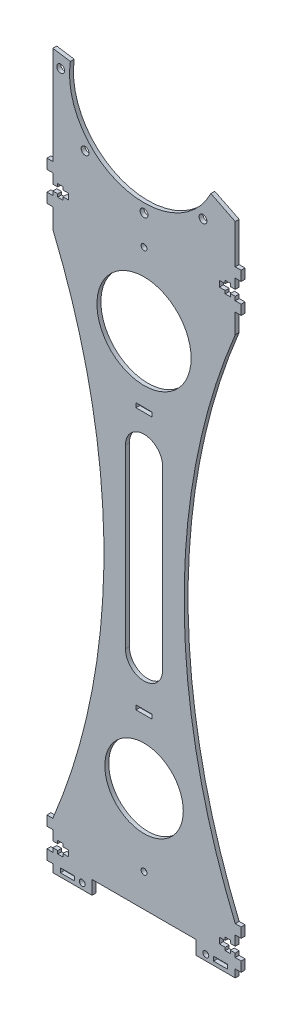
from build123d import *

# Parameters (mm, degrees)
SKETCH_3_R      = 1.5
SKETCH_3_R_2    = 2
SKETCH_3_R_3    = 24.001454592
SKETCH_3_R_4    = 20
SKETCH_3_W      = 7.2
SKETCH_3_H      = 2.2
SKETCH_3_W_2    = 8.2
EXTRUDE_1_DEPTH = 2


with BuildPart() as part:
    # 草图3 → 凸台-拉伸1 (new body)
    with BuildSketch(Plane.XY):
        with BuildLine():
            Line((-46.5, 360.009783315), (-46.5, 310.009783315))
            Line((-46.5, 310.009783315), (-49.5, 310.009783315))
            Line((-49.5, 310.009783315), (-49.5, 305.009783315))
            Line((-49.5, 305.009783315), (-46.5, 305.009783315))
            Line((-46.5, 305.009783315), (-46.5, 300.009783315))
            Line((-46.5, 300.009783315), (-44, 300.009783315))
            Line((-44, 300.009783315), (-44, 301.509783315))
            Line((-44, 301.509783315), (-41.4, 301.509783315))
            Line((-41.4, 301.509783315), (-41.4, 300.009783315))
            Line((-41.4, 300.009783315), (-38.4, 300.009783315))
            Line((-38.4, 300.009783315), (-38.4, 297.009783315))
            Line((-38.4, 297.009783315), (-41.4, 297.009783315))
            Line((-41.4, 297.009783315), (-41.4, 295.509783315))
            Line((-41.4, 295.509783315), (-44, 295.509783315))
            Line((-44, 295.509783315), (-44, 297.009783315))
            Line((-44, 297.009783315), (-46.5, 297.009783315))
            Line((-46.5, 297.009783315), (-46.5, 295.009783315))
            Line((-46.5, 295.009783315), (-49.5, 295.009783315))
            Line((-49.5, 295.009783315), (-49.5, 290.009783315))
            Line((-49.5, 290.009783315), (-46.5, 290.009783315))
            Line((-46.5, 290.009783315), (-46.5, 280.009783315))
            ThreePointArc((-46.5, 280.009783315), (-20.448024821, 150.009783315), (-46.5, 20.009783315))
            Line((-46.5, 20.009783315), (-49.5, 20.009783315))
            Line((-49.5, 20.009783315), (-49.5, 15.009783315))
            Line((-49.5, 15.009783315), (-46.5, 15.009783315))
            Line((-46.5, 15.009783315), (-46.5, 10.009783315))
            Line((-46.5, 10.009783315), (-44, 10.009783315))
            Line((-44, 10.009783315), (-44, 11.509783315))
            Line((-44, 11.509783315), (-41.4, 11.509783315))
            Line((-41.4, 11.509783315), (-41.4, 10.009783315))
            Line((-41.4, 10.009783315), (-38.4, 10.009783315))
            Line((-38.4, 10.009783315), (-38.4, 7.009783315))
            Line((-38.4, 7.009783315), (-41.4, 7.009783315))
            Line((-41.4, 7.009783315), (-41.4, 5.509783315))
            Line((-41.4, 5.509783315), (-44, 5.509783315))
            Line((-44, 5.509783315), (-44, 7.009783315))
            Line((-44, 7.009783315), (-46.5, 7.009783315))
            Line((-46.5, 7.009783315), (-46.5, 5.009783315))
            Line((-46.5, 5.009783315), (-49.5, 5.009783315))
            Line((-49.5, 5.009783315), (-49.5, 0.009783315))
            Line((-49.5, 0.009783315), (-46.5, 0.009783315))
            Line((-46.5, 0.009783315), (-46.5, -3.990216685))
            Line((-46.5, -3.990216685), (-26.5, -3.990216685))
            Line((-26.5, -3.990216685), (-26.5, 3.009783315))
            Line((-26.5, 3.009783315), (26.5, 3.009783315))
            Line((26.5, 3.009783315), (26.5, -3.990216685))
            Line((26.5, -3.990216685), (46.5, -3.990216685))
            Line((46.5, -3.990216685), (46.5, 0.009783315))
            Line((46.5, 0.009783315), (49.5, 0.009783315))
            Line((49.5, 0.009783315), (49.5, 5.009783315))
            Line((49.5, 5.009783315), (46.5, 5.009783315))
            Line((46.5, 5.009783315), (46.5, 7.009783315))
            Line((46.5, 7.009783315), (44, 7.009783315))
            Line((44, 7.009783315), (44, 5.509783315))
            Line((44, 5.509783315), (41.4, 5.509783315))
            Line((41.4, 5.509783315), (41.4, 7.009783315))
            Line((41.4, 7.009783315), (38.4, 7.009783315))
            Line((38.4, 7.009783315), (38.4, 10.009783315))
            Line((38.4, 10.009783315), (41.4, 10.009783315))
            Line((41.4, 10.009783315), (41.4, 11.509783315))
            Line((41.4, 11.509783315), (44, 11.509783315))
            Line((44, 11.509783315), (44, 10.009783315))
            Line((44, 10.009783315), (46.5, 10.009783315))
            Line((46.5, 10.009783315), (46.5, 15.009783315))
            Line((46.5, 15.009783315), (49.5, 15.009783315))
            Line((49.5, 15.009783315), (49.5, 20.009783315))
            Line((49.5, 20.009783315), (46.5, 20.009783315))
            ThreePointArc((46.5, 20.009783315), (20.448024821, 150.009783315), (46.5, 280.009783315))
            Line((46.5, 280.009783315), (46.5, 290.009783315))
            Line((46.5, 290.009783315), (49.5, 290.009783315))
            Line((49.5, 290.009783315), (49.5, 295.009783315))
            Line((49.5, 295.009783315), (46.5, 295.009783315))
            Line((46.5, 295.009783315), (46.5, 297.009783315))
            Line((46.5, 297.009783315), (44, 297.009783315))
            Line((44, 297.009783315), (44, 295.509783315))
            Line((44, 295.509783315), (41.4, 295.509783315))
            Line((41.4, 295.509783315), (41.4, 297.009783315))
            Line((41.4, 297.009783315), (38.4, 297.009783315))
            Line((38.4, 297.009783315), (38.4, 300.009783315))
            Line((38.4, 300.009783315), (41.4, 300.009783315))
            Line((41.4, 300.009783315), (41.4, 301.509783315))
            Line((41.4, 301.509783315), (44, 301.509783315))
            Line((44, 301.509783315), (44, 300.009783315))
            Line((44, 300.009783315), (46.5, 300.009783315))
            Line((46.5, 300.009783315), (46.5, 305.009783315))
            Line((46.5, 305.009783315), (49.5, 305.009783315))
            Line((49.5, 305.009783315), (49.5, 310.009783315))
            Line((49.5, 310.009783315), (46.5, 310.009783315))
            Line((46.5, 310.009783315), (46.5, 330.009783315))
            Line((46.5, 330.009783315), (34.06116735, 336.162324196))
            ThreePointArc((34.06116735, 336.162324196), (-11.38853896, 316.756491321), (-37.576612526, 358.666477673))
            Line((-37.576612526, 358.666477673), (-46.5, 360.009783315))
        make_face()
        with Locations((-31.5, -0.990216685)):
            Circle(SKETCH_3_R, mode=Mode.SUBTRACT)
        with Locations((31.5, -0.990216685)):
            Circle(SKETCH_3_R, mode=Mode.SUBTRACT)
        with Locations((0, 310.509783315)):
            Circle(SKETCH_3_R_2, mode=Mode.SUBTRACT)
        with Locations((-30.0520382, 322.957745114)):
            Circle(SKETCH_3_R_2, mode=Mode.SUBTRACT)
        with Locations((-42.5, 353.009783315)):
            Circle(SKETCH_3_R_2, mode=Mode.SUBTRACT)
        with Locations((30.0520382, 322.957745114)):
            Circle(SKETCH_3_R_2, mode=Mode.SUBTRACT)
        with Locations((0, 258.344771167)):
            Circle(SKETCH_3_R_3, mode=Mode.SUBTRACT)
        with Locations((0, 56.478199566)):
            Circle(SKETCH_3_R_4, mode=Mode.SUBTRACT)
        with Locations((0, 19.74399144)):
            Circle(SKETCH_3_R, mode=Mode.SUBTRACT)
        with Locations((0, 295.428004537)):
            Circle(SKETCH_3_R, mode=Mode.SUBTRACT)
        with Locations((-39, -0.990216685)):
            Rectangle(SKETCH_3_W, SKETCH_3_H, mode=Mode.SUBTRACT)
        with Locations((39, -0.990216685)):
            Rectangle(SKETCH_3_W, SKETCH_3_H, mode=Mode.SUBTRACT)
        with BuildLine():
            Line((-9.475517085, 113.355875718), (-9.475517085, 203.355875718))
            ThreePointArc((-9.475517085, 203.355875718), (0, 212.831392803), (9.475517085, 203.355875718))
            Line((9.475517085, 203.355875718), (9.475517085, 113.355875718))
            ThreePointArc((9.475517085, 113.355875718), (0, 103.880358633), (-9.475517085, 113.355875718))
        make_face(mode=Mode.SUBTRACT)
        with Locations((0, 90.179279099)):
            Rectangle(SKETCH_3_W_2, SKETCH_3_H, mode=Mode.SUBTRACT)
        with Locations((0, 223.587354689)):
            Rectangle(SKETCH_3_W_2, SKETCH_3_H, mode=Mode.SUBTRACT)
    extrude(amount=EXTRUDE_1_DEPTH)


solid = part.part
